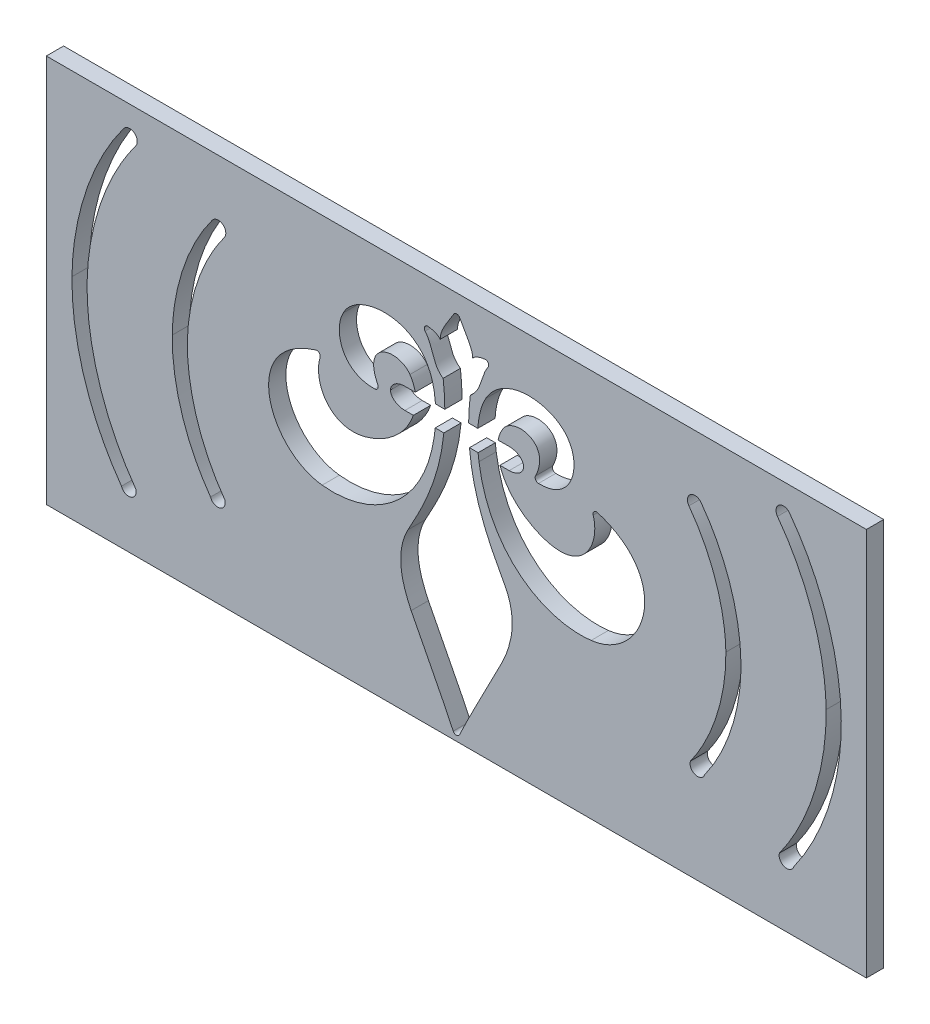
from build123d import *

# Parameters (mm, degrees)
MODEL_W             = 120.65
MODEL_H             = 57.15
BOSS_EXTRUDE1_DEPTH = 2.54


with BuildPart() as part:
    # Model → Boss-Extrude1 (new body)
    with BuildSketch(Plane.XY):
        with Locations((-89.314856437, 241.538566744)):
            Rectangle(MODEL_W, MODEL_H)
        with BuildLine():
            Line((-86.162719343, 254.405126972), (-87.510025142, 254.405126972))
            add(Edge.make_bspline(
                [(-87.510025142, 254.405126972), (-87.497548958, 255.574547526), (-87.421700192, 256.79508054), (-87.265349022, 258.071950278)],
                knots=[0, 0, 0, 0, 1, 1, 1, 1], degree=3))
            add(Edge.make_bspline(
                [(-87.265349022, 258.071950278), (-85.464681469, 259.550043017), (-85.721110886, 261.509548191), (-84.657787497, 262.93544811)],
                knots=[0, 0, 0, 0, 0.814236052, 0.814236052, 0.814236052, 0.814236052], degree=3))
            ThreePointArc((-84.657787497, 262.93544811), (-84.628168325, 263.498404736), (-85.136520813, 263.742075018))
            add(Edge.make_bspline(
                [(-85.136520813, 263.742075018), (-85.990590593, 263.620660495), (-86.635151257, 263.359894643), (-86.904908107, 262.982242385)],
                knots=[0.338376653, 0.338376653, 0.338376653, 0.338376653, 1, 1, 1, 1], degree=3))
            add(Edge.make_bspline(
                [(-86.904908107, 262.982242385), (-86.904908107, 264.131294082), (-87.952584063, 265.527199694), (-88.817353506, 267.163586531)],
                knots=[0, 0, 0, 0, 0.851527851, 0.851527851, 0.851527851, 0.851527851], degree=3))
            ThreePointArc((-88.817353506, 267.163586531), (-89.256046642, 267.434125135), (-89.705493856, 267.181855426))
            add(Edge.make_bspline(
                [(-89.705493856, 267.181855426), (-90.619978116, 265.611344261), (-91.692482661, 264.39091269), (-91.692482661, 262.982242385)],
                knots=[0.148939416, 0.148939416, 0.148939416, 0.148939416, 1, 1, 1, 1], degree=3))
            add(Edge.make_bspline(
                [(-91.692482661, 262.982242385), (-91.960714212, 263.357631749), (-92.599240232, 263.617531277), (-93.44566759, 263.739877464)],
                knots=[0, 0, 0, 0, 0.657658896, 0.657658896, 0.657658896, 0.657658896], degree=3))
            ThreePointArc((-93.44566759, 263.739877464), (-93.959944953, 263.488199694), (-93.91324536, 262.91754914))
            add(Edge.make_bspline(
                [(-93.91324536, 262.91754914), (-92.626234049, 261.327058768), (-92.878232703, 259.279924333), (-91.259057184, 258.237010401)],
                knots=[0.168492118, 0.168492118, 0.168492118, 0.168492118, 1, 1, 1, 1], degree=3))
            add(Edge.make_bspline(
                [(-91.259057184, 258.237010401), (-91.095858517, 256.903150212), (-91.022059568, 255.626441134), (-91.014242563, 254.405126972)],
                knots=[0, 0, 0, 0, 1, 1, 1, 1], degree=3))
            Line((-91.014242563, 254.405126972), (-92.385226517, 254.405126972))
            add(Edge.make_bspline(
                [(-92.385226517, 254.405126972), (-92.498564771, 256.020587688), (-92.849471267, 257.56569536), (-93.548486537, 258.799330582)],
                knots=[0, 0, 0, 0, 1, 1, 1, 1], degree=3))
            add(Edge.make_bspline(
                [(-93.548486537, 258.799330582), (-96.463320654, 263.942858613), (-104.165895526, 262.862444436), (-105.929314241, 259.257852466)],
                knots=[0, 0, 0, 0, 1, 1, 1, 1], degree=3))
            add(Edge.make_bspline(
                [(-105.929314241, 259.257852466), (-107.45341358, 256.572338123), (-106.198392878, 251.710809713), (-101.309723108, 251.856516705)],
                knots=[0, 0, 0, 0, 0.94986936, 0.94986936, 0.94986936, 0.94986936], degree=3))
            ThreePointArc((-101.309723108, 251.856516705), (-100.889505636, 252.102503349), (-100.869260553, 252.589003389))
            add(Edge.make_bspline(
                [(-100.869260553, 252.589003389), (-103.307176841, 257.531801253), (-97.830757497, 258.694212955), (-96.146313697, 256.27774553)],
                knots=[0.041687123, 0.041687123, 0.041687123, 0.041687123, 1, 1, 1, 1], degree=3))
            add(Edge.make_bspline(
                [(-96.146313697, 256.27774553), (-95.749352801, 255.70833963), (-95.4947323, 255.07459718), (-95.371216981, 254.405126972)],
                knots=[0, 0, 0, 0, 1, 1, 1, 1], degree=3))
            Line((-95.371216981, 254.405126972), (-96.882768596, 254.405126972))
            add(Edge.make_bspline(
                [(-96.882768596, 254.405126972), (-98.054161404, 254.405126974), (-99.003841582, 253.717020055), (-99.003841582, 252.868041288)],
                knots=[0, 0, 0, 0, 1, 1, 1, 1], degree=3))
            add(Edge.make_bspline(
                [(-99.003841582, 252.868041288), (-99.003841582, 252.019029281), (-98.054161404, 251.330938982), (-96.882768596, 251.330938981)],
                knots=[0, 0, 0, 0, 1, 1, 1, 1], degree=3))
            Line((-96.882768596, 251.330938981), (-95.640967346, 251.330938981))
            add(Edge.make_bspline(
                [(-95.640967346, 251.330938981), (-96.335533959, 249.254923188), (-98.014599937, 247.230053096), (-100.425151392, 245.962579275)],
                knots=[0, 0, 0, 0, 1, 1, 1, 1], degree=3))
            add(Edge.make_bspline(
                [(-100.425151392, 245.962579275), (-107.275906468, 242.360744733), (-110.536130032, 247.962541447), (-109.361868125, 251.848260954)],
                knots=[0, 0, 0, 0, 0.924254078, 0.924254078, 0.924254078, 0.924254078], degree=3))
            ThreePointArc((-109.361868125, 251.848260954), (-109.490500647, 252.355980416), (-109.999317507, 252.480201112))
            add(Edge.make_bspline(
                [(-109.999317507, 252.480201112), (-121.420183743, 248.920348342), (-117.036534764, 236.637565614), (-109.059805718, 235.723655129)],
                knots=[0.027727929, 0.027727929, 0.027727929, 0.027727929, 1, 1, 1, 1], degree=3))
            add(Edge.make_bspline(
                [(-109.059805718, 235.723655129), (-101.724452776, 234.883108311), (-94.007257723, 240.002487283), (-92.55532254, 250.24144467)],
                knots=[0, 0, 0, 0, 1, 1, 1, 1], degree=3))
            add(Edge.make_bspline(
                [(-92.55532254, 250.24144467), (-92.504664361, 250.598334415), (-92.461823188, 250.962636742), (-92.428366852, 251.330938981)],
                knots=[0, 0, 0, 0, 1, 1, 1, 1], degree=3))
            Line((-92.428366852, 251.330938981), (-91.158366852, 251.330938981))
            add(Edge.make_bspline(
                [(-91.158366852, 251.330938981), (-91.829072488, 244.417925886), (-94.718666157, 239.545832395), (-96.428207927, 236.362760343)],
                knots=[0, 0, 0, 0, 1, 1, 1, 1], degree=3))
            add(Edge.make_bspline(
                [(-96.428207927, 236.362760343), (-98.659250821, 232.208617997), (-96.848531196, 228.116236081), (-95.966611317, 226.285034908)],
                knots=[0, 0, 0, 0, 1, 1, 1, 1], degree=3))
            add(Edge.make_bspline(
                [(-95.966611317, 226.285034908), (-95.070515303, 224.424154478), (-91.367533089, 217.491668869), (-89.776632943, 214.021844145)],
                knots=[0, 0, 0, 0, 0.895911998, 0.895911998, 0.895911998, 0.895911998], degree=3))
            ThreePointArc((-89.776632943, 214.021844145), (-89.315197236, 213.725566858), (-88.853364422, 214.021224757))
            add(Edge.make_bspline(
                [(-88.853364422, 214.021224757), (-87.256921193, 217.490843804), (-83.526351117, 224.424043745), (-82.630236526, 226.285034908)],
                knots=[0.10403469, 0.10403469, 0.10403469, 0.10403469, 1, 1, 1, 1], degree=3))
            add(Edge.make_bspline(
                [(-82.630236526, 226.285034908), (-81.74856595, 228.116236081), (-79.937735524, 232.208617997), (-82.168778418, 236.362760343)],
                knots=[0, 0, 0, 0, 1, 1, 1, 1], degree=3))
            add(Edge.make_bspline(
                [(-82.168778418, 236.362760343), (-83.889871183, 239.567671255), (-86.764645229, 244.386519367), (-87.389180123, 251.330938981)],
                knots=[0, 0, 0, 0, 1, 1, 1, 1], degree=3))
            Line((-87.389180123, 251.330938981), (-86.119180124, 251.330938981))
            add(Edge.make_bspline(
                [(-86.119180124, 251.330938981), (-86.085408004, 250.962791863), (-86.042877073, 250.598334415), (-85.992218895, 250.24144467)],
                knots=[0, 0, 0, 0, 1, 1, 1, 1], degree=3))
            add(Edge.make_bspline(
                [(-85.992218895, 250.24144467), (-84.540422213, 240.002659025), (-76.8232327, 234.883108311), (-69.487863138, 235.723655129)],
                knots=[0, 0, 0, 0, 1, 1, 1, 1], degree=3))
            add(Edge.make_bspline(
                [(-69.487863138, 235.723655129), (-61.5110723, 236.637734119), (-57.127274019, 248.920545241), (-68.548677449, 252.480231519)],
                knots=[0, 0, 0, 0, 0.972273694, 0.972273694, 0.972273694, 0.972273694], degree=3))
            ThreePointArc((-68.548677449, 252.480231519), (-69.057487669, 252.356000565), (-69.186112704, 251.848283351))
            add(Edge.make_bspline(
                [(-69.186112704, 251.848283351), (-68.01181582, 247.962562974), (-71.272077851, 242.360737812), (-78.122800006, 245.962579275)],
                knots=[0.075744146, 0.075744146, 0.075744146, 0.075744146, 1, 1, 1, 1], degree=3))
            add(Edge.make_bspline(
                [(-78.122800006, 245.962579275), (-80.533395781, 247.230053096), (-82.212290018, 249.254923188), (-82.907028372, 251.330938981)],
                knots=[0, 0, 0, 0, 1, 1, 1, 1], degree=3))
            Line((-82.907028372, 251.330938981), (-81.548841842, 251.330938981))
            add(Edge.make_bspline(
                [(-81.548841842, 251.330938981), (-80.377415794, 251.330938982), (-79.427718996, 252.01887416), (-79.427718996, 252.868041288)],
                knots=[0, 0, 0, 0, 1, 1, 1, 1], degree=3))
            add(Edge.make_bspline(
                [(-79.427718996, 252.868041288), (-79.427718996, 253.716876014), (-80.377415794, 254.405126974), (-81.548841842, 254.405126972)],
                knots=[0, 0, 0, 0, 1, 1, 1, 1], degree=3))
            Line((-81.548841842, 254.405126972), (-83.176612536, 254.405126972))
            add(Edge.make_bspline(
                [(-83.176612536, 254.405126972), (-83.052980877, 255.07459718), (-82.798471176, 255.70833963), (-82.401698641, 256.27774553)],
                knots=[0, 0, 0, 0, 1, 1, 1, 1], degree=3))
            add(Edge.make_bspline(
                [(-82.401698641, 256.27774553), (-80.717213484, 258.694211355), (-75.240650961, 257.531802793), (-77.678679298, 252.589013205)],
                knots=[0, 0, 0, 0, 0.958312242, 0.958312242, 0.958312242, 0.958312242], degree=3))
            ThreePointArc((-77.678679298, 252.589013205), (-77.658440394, 252.10250777), (-77.238218892, 251.856517849))
            add(Edge.make_bspline(
                [(-77.238218892, 251.856517849), (-72.349444376, 251.710827944), (-71.094401848, 256.572501773), (-72.618648238, 259.257852466)],
                knots=[0.050130823, 0.050130823, 0.050130823, 0.050130823, 1, 1, 1, 1], degree=3))
            add(Edge.make_bspline(
                [(-72.618648238, 259.257852466), (-74.382083572, 262.862444436), (-82.084658445, 263.942731192), (-84.999492562, 258.799330582)],
                knots=[0, 0, 0, 0, 1, 1, 1, 1], degree=3))
            add(Edge.make_bspline(
                [(-84.999492562, 258.799330582), (-85.69835271, 257.56569536), (-86.049364467, 256.020587688), (-86.162719343, 254.405126972)],
                knots=[0, 0, 0, 0, 1, 1, 1, 1], degree=3))
        make_face(mode=Mode.SUBTRACT)
        with BuildLine():
            ThreePointArc((-125.482386421, 226.0088639), (-124.091837597, 225.286546449), (-123.369520147, 226.677095273))
            add(Edge.make_bspline(
                [(-123.369520147, 226.677095273), (-126.942750712, 231.628534626), (-128.969587355, 238.037125713), (-128.893349676, 244.142771964)],
                knots=[0, 0, 0, 0, 1, 1, 1, 1], degree=3))
            add(Edge.make_bspline(
                [(-128.893349676, 244.142771964), (-128.786289479, 249.752266231), (-126.801835054, 255.568451382), (-123.45531424, 260.071637616)],
                knots=[0, 0, 0, 0, 0.989781358, 0.989781358, 0.989781358, 0.989781358], degree=3))
            ThreePointArc((-123.45531424, 260.071637616), (-123.683741698, 261.621859995), (-125.233964077, 261.393432538))
            add(Edge.make_bspline(
                [(-125.233964077, 261.393432538), (-128.919160607, 256.434513348), (-131.037071189, 249.993813584), (-131.114202826, 243.815981949)],
                knots=[0, 0, 0, 0, 1.009909674, 1.009909674, 1.009909674, 1.009909674], degree=3))
            add(Edge.make_bspline(
                [(-131.114202826, 243.815981949), (-131.191930658, 237.590974723), (-129.125471254, 231.057100175), (-125.482386421, 226.0088639)],
                knots=[0, 0, 0, 0, 1, 1, 1, 1], degree=3))
        make_face(mode=Mode.SUBTRACT)
        with BuildLine():
            ThreePointArc((-138.584628012, 220.8425228), (-137.194079116, 220.120205487), (-136.471761803, 221.510754382))
            add(Edge.make_bspline(
                [(-136.471761803, 221.510754382), (-141.114282856, 227.94390676), (-143.747641002, 236.270266636), (-143.648596405, 244.203024124)],
                knots=[0, 0, 0, 0, 1, 1, 1, 1], degree=3))
            add(Edge.make_bspline(
                [(-143.648596405, 244.203024124), (-143.518927401, 251.60895755), (-140.903407368, 259.292809172), (-136.485301257, 265.237975472)],
                knots=[0, 0, 0, 0, 0.992225282, 0.992225282, 0.992225282, 0.992225282], degree=3))
            ThreePointArc((-136.485301257, 265.237975472), (-136.713731257, 266.788197478), (-138.263953262, 266.559767478))
            add(Edge.make_bspline(
                [(-138.263953262, 266.559767478), (-143.020804572, 260.158773162), (-145.769748168, 251.850176829), (-145.869316999, 243.875814869)],
                knots=[0, 0, 0, 0, 1.007594664, 1.007594664, 1.007594664, 1.007594664], degree=3))
            add(Edge.make_bspline(
                [(-145.869316999, 243.875814869), (-145.969850096, 235.823842889), (-143.296917427, 227.372353439), (-138.584628012, 220.8425228)],
                knots=[0, 0, 0, 0, 1, 1, 1, 1], degree=3))
        make_face(mode=Mode.SUBTRACT)
        with BuildLine():
            ThreePointArc((-41.776327199, 222.494186715), (-41.054009886, 221.10363782), (-39.663460991, 221.825955133))
            add(Edge.make_bspline(
                [(-39.663460991, 221.825955133), (-35.152368077, 228.076987302), (-32.593559277, 236.167630896), (-32.6898, 243.875814869)],
                knots=[0, 0, 0, 0, 1, 1, 1, 1], degree=3))
            add(Edge.make_bspline(
                [(-32.6898, 243.875814869), (-32.789368831, 251.850176829), (-35.538312428, 260.158773162), (-40.295163737, 266.559767478)],
                knots=[0, 0, 0, 0, 1.007594664, 1.007594664, 1.007594664, 1.007594664], degree=3))
            ThreePointArc((-40.295163737, 266.559767478), (-41.845385742, 266.788197478), (-42.073815741, 265.237975472))
            add(Edge.make_bspline(
                [(-42.073815741, 265.237975472), (-37.655709631, 259.292809172), (-35.040189598, 251.60895755), (-34.910520595, 244.203024124)],
                knots=[0, 0, 0, 0, 0.992225282, 0.992225282, 0.992225282, 0.992225282], degree=3))
            add(Edge.make_bspline(
                [(-34.910520595, 244.203024124), (-34.815768369, 236.614054643), (-37.335002649, 228.648540624), (-41.776327199, 222.494186715)],
                knots=[0, 0, 0, 0, 1, 1, 1, 1], degree=3))
        make_face(mode=Mode.SUBTRACT)
        with BuildLine():
            ThreePointArc((-53.325152431, 261.393431878), (-54.875374641, 261.621860486), (-55.103803249, 260.071638276))
            add(Edge.make_bspline(
                [(-55.103803249, 260.071638276), (-51.757285621, 255.568449347), (-49.772827635, 249.752266486), (-49.665767325, 244.142771959)],
                knots=[0, 0, 0, 0, 0.989781357, 0.989781357, 0.989781357, 0.989781357], degree=3))
            add(Edge.make_bspline(
                [(-49.665767325, 244.142771959), (-49.593820503, 238.380767506), (-51.506581459, 232.332868748), (-54.878701228, 227.660109398)],
                knots=[0, 0, 0, 0, 1, 1, 1, 1], degree=3))
            ThreePointArc((-54.878701228, 227.660109398), (-54.156383777, 226.269560574), (-52.765834953, 226.991878025))
            add(Edge.make_bspline(
                [(-52.765834953, 226.991878025), (-49.323860927, 231.761434306), (-47.371477184, 237.93461652), (-47.444914173, 243.815981949)],
                knots=[0, 0, 0, 0, 1, 1, 1, 1], degree=3))
            add(Edge.make_bspline(
                [(-47.444914173, 243.815981949), (-47.522045807, 249.993813323), (-49.639959737, 256.434510162), (-53.325152431, 261.393431878)],
                knots=[0, 0, 0, 0, 1.009909674, 1.009909674, 1.009909674, 1.009909674], degree=3))
        make_face(mode=Mode.SUBTRACT)
    extrude(amount=BOSS_EXTRUDE1_DEPTH)


solid = part.part
